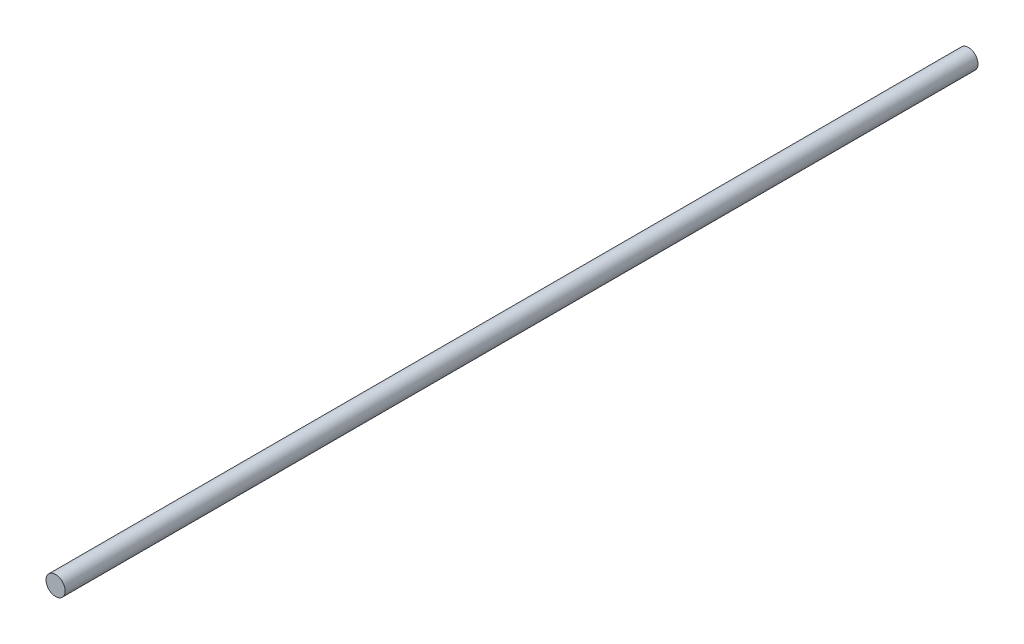
from build123d import *

# Parameters (mm, degrees)
SKETCH1_R           = 4
BOSS_EXTRUDE1_DEPTH = 381.12


with BuildPart() as part:
    # Sketch1 → Boss-Extrude1 (new body)
    with BuildSketch(Plane.XY):
        Circle(SKETCH1_R)
    extrude(amount=BOSS_EXTRUDE1_DEPTH)


solid = part.part
